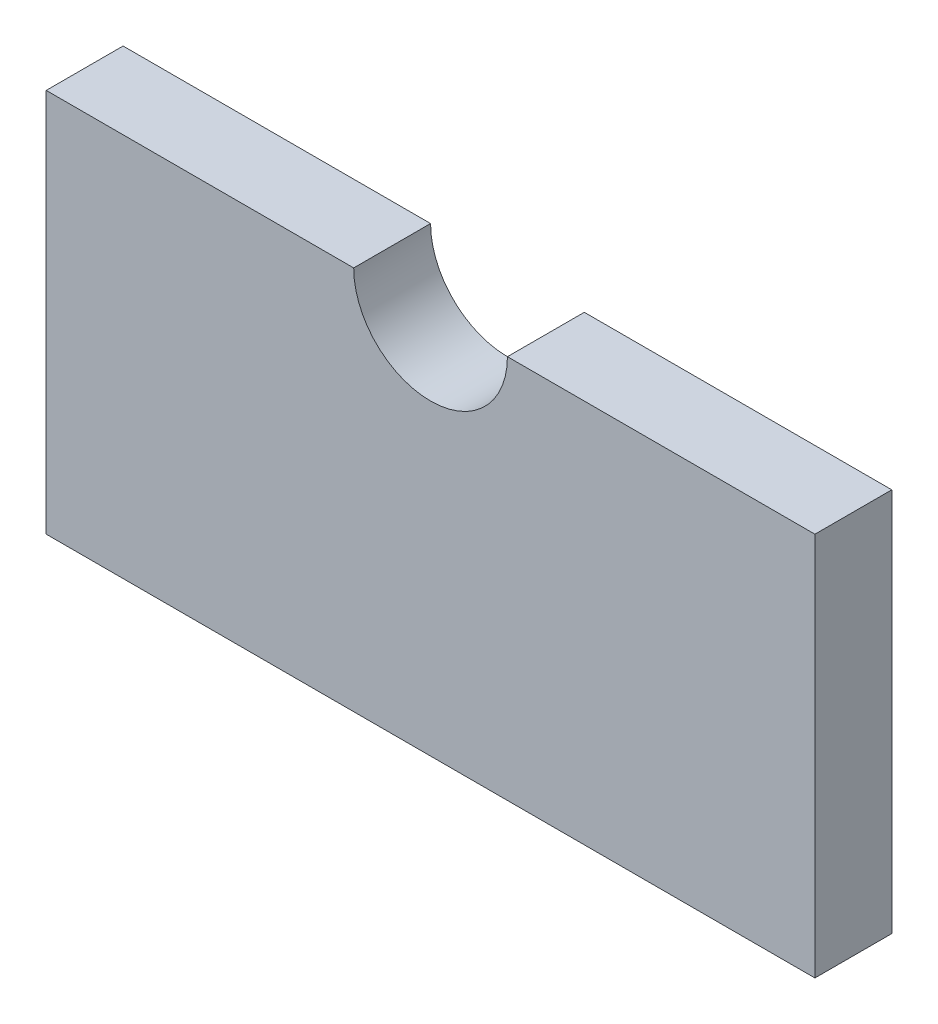
from build123d import *

# Parameters (mm, degrees)
SKETCH2_W           = 50
SKETCH2_H           = 25
BOSS_EXTRUDE2_DEPTH = 5
CUT_EXTRUDE1_DEPTH  = 5


with BuildPart() as part:
    # Sketch2 → Boss-Extrude2 (new body)
    with BuildSketch(Plane.XY):
        Rectangle(SKETCH2_W, SKETCH2_H)
    extrude(amount=BOSS_EXTRUDE2_DEPTH)

    # Sketch6 → Cut-Extrude1 (cut)
    with BuildSketch(Plane.XY):
        with BuildLine():
            Line((-5, 12.5), (5, 12.5))
            ThreePointArc((5, 12.5), (0, 7.5), (-5, 12.5))
        make_face()
    extrude(amount=CUT_EXTRUDE1_DEPTH, mode=Mode.SUBTRACT)


solid = part.part
